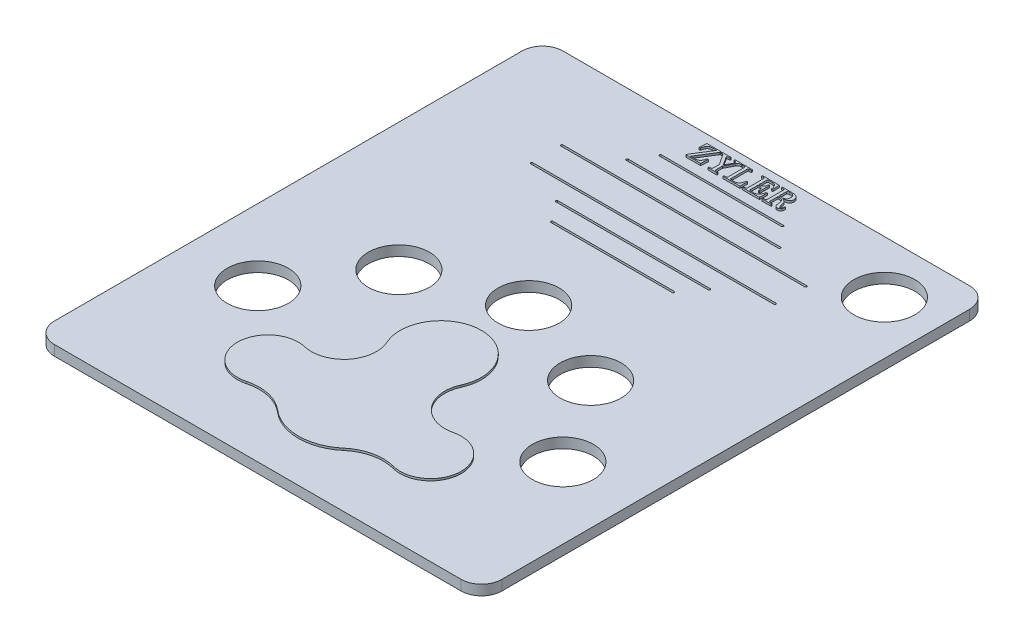
from build123d import *

# Parameters (mm, degrees)
SKETCH1_W           = 220
SKETCH1_H           = 250
BOSS_EXTRUDE1_DEPTH = 5
CUT_EXTRUDE1_DEPTH  = 20
SKETCH3_R           = 15
CUT_EXTRUDE2_DEPTH  = 20
BOSS_EXTRUDE2_DEPTH = 1
BOSS_EXTRUDE3_DEPTH = 1
FILLET1_R           = 10
SKETCH6_R           = 15
CUT_EXTRUDE3_DEPTH  = 167.583312631


with BuildPart() as part:
    # Sketch1 → Boss-Extrude1 (new body)
    with BuildSketch(Plane(origin=(0, 0, 0), x_dir=(1, 0, 0), z_dir=(0, 1, 0))):
        Rectangle(SKETCH1_W, SKETCH1_H)
    extrude(amount=BOSS_EXTRUDE1_DEPTH)

    # Sketch2 → Cut-Extrude1 (cut)
    with BuildSketch(Plane(origin=(0, 5, 0), x_dir=(1, 0, 0), z_dir=(0, 1, 0))):
        with BuildLine():
            Line((37.083433969, 94), (-37.916566031, 94))
            ThreePointArc((-37.916566031, 94), (-38.416566031, 94.5), (-37.916566031, 95))
            Line((-37.916566031, 95), (37.083433969, 95))
            ThreePointArc((37.083433969, 95), (37.583433969, 94.5), (37.083433969, 94))
        make_face()
        with BuildLine():
            Line((59.972615029, 84.007575965), (-60.027384971, 84.007575965))
            ThreePointArc((-60.027384971, 84.007575965), (-60.527384971, 84.507575965), (-60.027384971, 85.007575965))
            Line((-60.027384971, 85.007575965), (59.972615029, 85.007575965))
            ThreePointArc((59.972615029, 85.007575965), (60.472615029, 84.507575965), (59.972615029, 84.007575965))
        make_face()
        with BuildLine():
            Line((59.724735753, 69.007576115), (-59.775264247, 69.007576115))
            ThreePointArc((-59.775264247, 69.007576115), (-60.275264247, 69.507576115), (-59.775264247, 70.007576115))
            Line((-59.775264247, 70.007576115), (59.724735753, 70.007576115))
            ThreePointArc((59.724735753, 70.007576115), (60.224735753, 69.507576115), (59.724735753, 69.007576115))
        make_face()
        with BuildLine():
            Line((37.474735753, 59.007576115), (-37.525264247, 59.007576115))
            ThreePointArc((-37.525264247, 59.007576115), (-38.025264247, 59.507576115), (-37.525264247, 60.007576115))
            Line((-37.525264247, 60.007576115), (37.474735753, 60.007576115))
            ThreePointArc((37.474735753, 60.007576115), (37.974735753, 59.507576115), (37.474735753, 59.007576115))
        make_face()
        with BuildLine():
            Line((28.500891685, 104), (-31.499108315, 104))
            ThreePointArc((-31.499108315, 104), (-31.999108315, 104.5), (-31.499108315, 105))
            Line((-31.499108315, 105), (28.500891685, 105))
            ThreePointArc((28.500891685, 105), (29.000891685, 104.5), (28.500891685, 104))
        make_face()
        with BuildLine():
            Line((29.812177864, 49.007576115), (-29.862706357, 49.007576115))
            ThreePointArc((-29.862706357, 49.007576115), (-30.362706357, 49.507576115), (-29.862706357, 50.007576115))
            Line((-29.862706357, 50.007576115), (29.812177864, 50.007576115))
            ThreePointArc((29.812177864, 50.007576115), (30.312177864, 49.507576115), (29.812177864, 49.007576115))
        make_face()
    extrude(amount=-CUT_EXTRUDE1_DEPTH, mode=Mode.SUBTRACT)

    # Sketch3 → Cut-Extrude2 (cut)
    with BuildSketch(Plane(origin=(0, 5, 0), x_dir=(1, 0, 0), z_dir=(0, 1, 0))):
        with Locations(Location((-75, -50, 0), (0, 0, 270))):
            Circle(SKETCH3_R)
        with Locations(Location((-47.142827339, -8.47918677, 0), (0, 0, 270))):
            Circle(SKETCH3_R)
        with Locations(Location((0, 8.180760125, 0), (0, 0, 270))):
            Circle(SKETCH3_R)
        with Locations(Location((75, -50, 0), (0, 0, 270))):
            Circle(SKETCH3_R)
        with Locations(Location((47.142827339, -8.47918677, 0), (0, 0, 270))):
            Circle(SKETCH3_R)
    extrude(amount=-CUT_EXTRUDE2_DEPTH, mode=Mode.SUBTRACT)

    # Sketch4 → Boss-Extrude2 (add)
    with BuildSketch(Plane(origin=(0, 5, 0), x_dir=(1, 0, 0), z_dir=(0, 1, 0))):
        with BuildLine():
            ThreePointArc((18.21942281, -43.249401947), (0, -15), (-18.21942281, -43.249401947))
            ThreePointArc((-18.21942281, -43.249401947), (-20.456033843, -60.03474086), (-36.513690834, -65.410769438))
            ThreePointArc((-36.513690834, -65.410769438), (-54.998818818, -80.188239417), (-36.148648649, -94.497140848))
            ThreePointArc((-36.148648649, -94.497140848), (-25.628978083, -94.30563671), (-16.223404255, -99.021071325))
            ThreePointArc((-16.223404255, -99.021071325), (0, -105), (16.223404255, -99.021071325))
            ThreePointArc((16.223404255, -99.021071325), (25.628978083, -94.30563671), (36.148648649, -94.497140848))
            ThreePointArc((36.148648649, -94.497140848), (54.998818818, -80.188239417), (36.513690834, -65.410769438))
            ThreePointArc((36.513690834, -65.410769438), (20.456033843, -60.03474086), (18.21942281, -43.249401947))
        make_face()
    extrude(amount=BOSS_EXTRUDE2_DEPTH)

    # Sketch5 → Boss-Extrude3 (add)
    # profile 1 of 5: a face of its own
    with BuildSketch(Plane(origin=(0, 5, 0), x_dir=(1, 0, 0), z_dir=(0, 1, 0))):
        with BuildLine():
            Line((-24.154647436, 120), (-17.179487179, 120))
            Line((-17.179487179, 120), (-17.179487179, 119.487179487))
            Line((-17.179487179, 119.487179487), (-22.804487179, 110.512820513))
            Line((-22.804487179, 110.512820513), (-20.673076923, 110.512820513))
            add(Edge.make_bspline(
                [(-20.673076923, 110.512820513), (-20.526651144, 110.515887223), (-20.247389804, 110.521736014), (-19.84912992, 110.57628319), (-19.491872335, 110.66428805), (-19.173584535, 110.791911861), (-18.890563731, 110.956557482), (-18.638367295, 111.157614665), (-18.411539151, 111.391175177), (-18.248417489, 111.617899109), (-18.129942276, 111.823859128), (-18.04180762, 112.004369556), (-17.959053906, 112.210119375), (-17.874482462, 112.438237578), (-17.792689455, 112.691619812), (-17.712898856, 112.968796328), (-17.637231289, 113.271186263), (-17.5891079, 113.480817404), (-17.564102564, 113.58974359)],
                knots=[0, 0, 0, 0, 1.438938695, 2.744325145, 3.943287961, 5.047781886, 6.103944204, 7.15076122, 8.209328403, 9.295327535, 9.886501639, 10.544177767, 11.26834914, 12.065930381, 12.935805495, 13.885366719, 14.901217933, 16, 16, 16, 16], degree=3))
            Line((-17.564102564, 113.58974359), (-17.051282051, 113.58974359))
            Line((-17.051282051, 113.58974359), (-17.249599359, 110))
            Line((-17.249599359, 110), (-24.487179487, 110))
            Line((-24.487179487, 110), (-24.487179487, 110.458733974))
            Line((-24.487179487, 110.458733974), (-18.826121795, 119.487179487))
            Line((-18.826121795, 119.487179487), (-20.909455128, 119.487179487))
            add(Edge.make_bspline(
                [(-20.909455128, 119.487179487), (-21.043807402, 119.485425547), (-21.297096594, 119.482118912), (-21.653399479, 119.443458441), (-21.964378916, 119.385150531), (-22.148149278, 119.315315102), (-22.233573718, 119.282852564)],
                knots=[0, 0, 0, 0, 1.195148331, 2.253167325, 3.18799636, 4, 4, 4, 4], degree=3))
            add(Edge.make_bspline(
                [(-22.233573718, 119.282852564), (-22.286061606, 119.25827604), (-22.391152301, 119.209069182), (-22.541813204, 119.120684756), (-22.684560242, 119.018013108), (-22.819308501, 118.901332309), (-22.945792151, 118.769908876), (-23.065628563, 118.625975922), (-23.178455392, 118.468888939), (-23.282728061, 118.298058615), (-23.378354765, 118.112722554), (-23.469333318, 117.914032542), (-23.550757543, 117.69965804), (-23.624621303, 117.470071964), (-23.692796894, 117.226310318), (-23.752435357, 116.967562411), (-23.805069719, 116.694330206), (-23.832229475, 116.506535658), (-23.846153846, 116.41025641)],
                knots=[0, 0, 0, 0, 0.807180279, 1.616127815, 2.429396883, 3.253816916, 4.095946098, 4.967866624, 5.861164287, 6.78817231, 7.75355223, 8.765247396, 9.831261868, 10.946284167, 12.12452188, 13.356655795, 14.644799893, 16, 16, 16, 16], degree=3))
            Line((-23.846153846, 116.41025641), (-24.358974359, 116.41025641))
            Line((-24.358974359, 116.41025641), (-24.154647436, 120))
        make_face()
    # profile 2 of 5: a face of its own
    with BuildSketch(Plane(origin=(0, 5, 0), x_dir=(1, 0, 0), z_dir=(0, 1, 0))):
        with BuildLine():
            Line((-16.666666667, 120), (-12.307692308, 120))
            Line((-12.307692308, 120), (-12.307692308, 119.487179487))
            Line((-12.307692308, 119.487179487), (-12.760416667, 119.487179487))
            add(Edge.make_bspline(
                [(-12.760416667, 119.487179487), (-12.846619261, 119.486424128), (-13.002559406, 119.485057687), (-13.211899108, 119.466702823), (-13.374538956, 119.44314865), (-13.493287129, 119.401205813), (-13.575234414, 119.346644783), (-13.629860927, 119.283175014), (-13.667727251, 119.211211133), (-13.670476211, 119.157791294), (-13.671875, 119.130608974)],
                knots=[0, 0, 0, 0, 1.913714744, 3.461902253, 4.666412246, 5.553424366, 6.236294336, 6.825067748, 7.40214376, 8, 8, 8, 8], degree=3))
            add(Edge.make_bspline(
                [(-13.671875, 119.130608974), (-13.667805003, 119.074009925), (-13.65971831, 118.961553038), (-13.604935316, 118.863036278), (-13.577724359, 118.814102564)],
                knots=[0, 0, 0, 0, 1.006591081, 2, 2, 2, 2], degree=3))
            Line((-13.577724359, 118.814102564), (-10.987580128, 114.815705128))
            Line((-10.987580128, 114.815705128), (-9.184695513, 118.235176282))
            add(Edge.make_bspline(
                [(-9.184695513, 118.235176282), (-9.165597886, 118.272778748), (-9.127731925, 118.347335311), (-9.089751755, 118.467562005), (-9.067531445, 118.59224725), (-9.064187293, 118.677126214), (-9.0625, 118.719951923)],
                knots=[0, 0, 0, 0, 1.000544011, 1.983835969, 2.982743766, 4, 4, 4, 4], degree=3))
            add(Edge.make_bspline(
                [(-9.0625, 118.719951923), (-9.064946926, 118.775661857), (-9.069653571, 118.882819527), (-9.112889746, 119.035564249), (-9.185820396, 119.169503747), (-9.286675615, 119.28385013), (-9.411745305, 119.378065781), (-9.564875614, 119.440868838), (-9.739363051, 119.482546004), (-9.864173425, 119.48558134), (-9.929887821, 119.487179487)],
                knots=[0, 0, 0, 0, 1.018724209, 1.959508948, 2.878985283, 3.789059353, 4.733256338, 5.719300026, 6.799179769, 8, 8, 8, 8], degree=3))
            Line((-9.929887821, 119.487179487), (-10.384615385, 119.487179487))
            Line((-10.384615385, 119.487179487), (-10.384615385, 120))
            Line((-10.384615385, 120), (-6.666666667, 120))
            Line((-6.666666667, 120), (-6.666666667, 119.487179487))
            add(Edge.make_bspline(
                [(-6.666666667, 119.487179487), (-6.776976562, 119.484738833), (-6.986471081, 119.480103675), (-7.283359654, 119.439002663), (-7.543860609, 119.368009102), (-7.775289427, 119.265655716), (-7.9820443, 119.117578993), (-8.180373181, 118.924970302), (-8.373501315, 118.681796276), (-8.488874715, 118.49557784), (-8.549679487, 118.397435897)],
                knots=[0, 0, 0, 0, 1.144733651, 2.174015535, 3.102350986, 3.939892726, 4.785995591, 5.727257514, 6.802205801, 8, 8, 8, 8], degree=3))
            Line((-8.549679487, 118.397435897), (-10.769230769, 114.190705128))
            Line((-10.769230769, 114.190705128), (-10.769230769, 111.015625))
            add(Edge.make_bspline(
                [(-10.769230769, 111.015625), (-10.768016936, 110.976736695), (-10.765724465, 110.903291476), (-10.740404304, 110.801729417), (-10.695538714, 110.717095919), (-10.652231059, 110.675453519), (-10.631009615, 110.655048077)],
                knots=[0, 0, 0, 0, 1.166754949, 2.203556381, 3.119713918, 4, 4, 4, 4], degree=3))
            add(Edge.make_bspline(
                [(-10.631009615, 110.655048077), (-10.596405969, 110.632717835), (-10.52312864, 110.585430897), (-10.389433695, 110.545010103), (-10.235732773, 110.515191144), (-10.125060093, 110.513644432), (-10.066105769, 110.512820513)],
                knots=[0, 0, 0, 0, 0.831441795, 1.760676714, 2.807132964, 4, 4, 4, 4], degree=3))
            Line((-10.066105769, 110.512820513), (-9.230769231, 110.512820513))
            Line((-9.230769231, 110.512820513), (-9.230769231, 110))
            Line((-9.230769231, 110), (-13.717948718, 110))
            Line((-13.717948718, 110), (-13.717948718, 110.512820513))
            Line((-13.717948718, 110.512820513), (-12.844551282, 110.512820513))
            add(Edge.make_bspline(
                [(-12.844551282, 110.512820513), (-12.789640668, 110.513844482), (-12.687110261, 110.515756462), (-12.54645653, 110.542436781), (-12.428011355, 110.580409042), (-12.335004046, 110.640071097), (-12.264652644, 110.715038829), (-12.21262867, 110.802785346), (-12.185338447, 110.90588992), (-12.181488624, 110.978089779), (-12.179487179, 111.015625)],
                knots=[0, 0, 0, 0, 1.38374589, 2.583763285, 3.601916947, 4.50424506, 5.338860912, 6.1772126, 7.052370344, 8, 8, 8, 8], degree=3))
            Line((-12.179487179, 111.015625), (-12.179487179, 114.102564103))
            Line((-12.179487179, 114.102564103), (-15.294471154, 118.914262821))
            add(Edge.make_bspline(
                [(-15.294471154, 118.914262821), (-15.328761117, 118.963174956), (-15.394529517, 119.056988789), (-15.507703767, 119.179878436), (-15.631439347, 119.276720212), (-15.768004095, 119.355748613), (-15.933308923, 119.413345141), (-16.137940019, 119.449565637), (-16.386834772, 119.477912285), (-16.568408874, 119.483925481), (-16.666666667, 119.487179487)],
                knots=[0, 0, 0, 0, 0.914989527, 1.754956588, 2.549357515, 3.314817421, 4.162974635, 5.216717468, 6.493842491, 8, 8, 8, 8], degree=3))
            Line((-16.666666667, 119.487179487), (-16.666666667, 120))
        make_face()
    # profile 3 of 5: a face of its own
    with BuildSketch(Plane(origin=(0, 5, 0), x_dir=(1, 0, 0), z_dir=(0, 1, 0))):
        with BuildLine():
            Line((-6.282051282, 120), (-1.794871795, 120))
            Line((-1.794871795, 120), (-1.794871795, 119.487179487))
            Line((-1.794871795, 119.487179487), (-2.846554487, 119.487179487))
            add(Edge.make_bspline(
                [(-2.846554487, 119.487179487), (-2.885440617, 119.486001526), (-2.958881728, 119.483776804), (-3.061622564, 119.457717003), (-3.147966514, 119.412936681), (-3.218951315, 119.350972987), (-3.273095786, 119.268908901), (-3.306968109, 119.166795653), (-3.329400959, 119.046109242), (-3.331956444, 118.959125985), (-3.333333333, 118.912259615)],
                knots=[0, 0, 0, 0, 1.074881894, 2.03004312, 2.906641272, 3.744969235, 4.611566723, 5.594071665, 6.703691602, 8, 8, 8, 8], degree=3))
            Line((-3.333333333, 118.912259615), (-3.333333333, 111.033653846))
            add(Edge.make_bspline(
                [(-3.333333333, 111.033653846), (-3.331813547, 110.989355979), (-3.328984766, 110.906904305), (-3.298254878, 110.793661432), (-3.250136202, 110.699598774), (-3.177067476, 110.623409855), (-3.070410278, 110.570502626), (-2.929707758, 110.53798723), (-2.751708486, 110.516588987), (-2.620271509, 110.51415657), (-2.548076923, 110.512820513)],
                knots=[0, 0, 0, 0, 0.968859683, 1.803339694, 2.549864827, 3.264120922, 4.076087224, 5.119893098, 6.418039341, 8, 8, 8, 8], degree=3))
            Line((-2.548076923, 110.512820513), (-1.163862179, 110.512820513))
            add(Edge.make_bspline(
                [(-1.163862179, 110.512820513), (-1.073626073, 110.515360461), (-0.897251978, 110.520325004), (-0.638198498, 110.552495136), (-0.391521324, 110.607747699), (-0.158565788, 110.688947497), (0.061885808, 110.789451088), (0.269999641, 110.912207294), (0.464421912, 111.05983224), (0.649309266, 111.229320456), (0.820810091, 111.428075017), (0.979280348, 111.657685378), (1.123586393, 111.921559869), (1.256296259, 112.217316869), (1.378915374, 112.545800128), (1.487787352, 112.90671454), (1.58660148, 113.300385275), (1.639338344, 113.575423495), (1.666666667, 113.717948718)],
                knots=[0, 0, 0, 0, 0.916575025, 1.791523346, 2.64714501, 3.479407927, 4.292800653, 5.104749812, 5.928176648, 6.768170195, 7.648073394, 8.588823798, 9.596786844, 10.698706982, 11.879178132, 13.15579527, 14.526128792, 16, 16, 16, 16], degree=3))
            Line((1.666666667, 113.717948718), (2.179487179, 113.717948718))
            Line((2.179487179, 113.717948718), (2.051282051, 110))
            Line((2.051282051, 110), (-6.282051282, 110))
            Line((-6.282051282, 110), (-6.282051282, 110.512820513))
            Line((-6.282051282, 110.512820513), (-5.482772436, 110.512820513))
            add(Edge.make_bspline(
                [(-5.482772436, 110.512820513), (-5.419859583, 110.5144311), (-5.302547727, 110.517434317), (-5.14228296, 110.546540049), (-5.009803146, 110.593508835), (-4.90637767, 110.665797518), (-4.83217737, 110.763368693), (-4.779432882, 110.881775729), (-4.747801717, 111.024024666), (-4.745055261, 111.126962855), (-4.743589744, 111.181891026)],
                knots=[0, 0, 0, 0, 1.302472546, 2.428684546, 3.361496608, 4.194680969, 5.002904928, 5.869761089, 6.863297216, 8, 8, 8, 8], degree=3))
            Line((-4.743589744, 111.181891026), (-4.743589744, 118.98036859))
            add(Edge.make_bspline(
                [(-4.743589744, 118.98036859), (-4.74478198, 119.019911115), (-4.747035311, 119.094646655), (-4.772956929, 119.199436907), (-4.818357198, 119.28784359), (-4.87936354, 119.362707134), (-4.960071581, 119.419274336), (-5.056421517, 119.459316923), (-5.169109185, 119.483434912), (-5.249603474, 119.485878329), (-5.292467949, 119.487179487)],
                knots=[0, 0, 0, 0, 1.109388179, 2.096748346, 3.002883726, 3.882011267, 4.782692644, 5.74092925, 6.797009297, 8, 8, 8, 8], degree=3))
            Line((-5.292467949, 119.487179487), (-6.282051282, 119.487179487))
            Line((-6.282051282, 119.487179487), (-6.282051282, 120))
        make_face()
    # profile 4 of 5: a face of its own
    with BuildSketch(Plane(origin=(0, 5, 0), x_dir=(1, 0, 0), z_dir=(0, 1, 0))):
        with BuildLine():
            Line((3.205128205, 120), (11.41025641, 120))
            Line((11.41025641, 120), (11.538461538, 116.666666667))
            Line((11.538461538, 116.666666667), (11.025641026, 116.666666667))
            add(Edge.make_bspline(
                [(11.025641026, 116.666666667), (11.003009398, 116.793165235), (10.95932247, 117.037351552), (10.873429975, 117.385570812), (10.783748393, 117.705729513), (10.677982277, 117.994409143), (10.56820196, 118.25664019), (10.443096258, 118.486935057), (10.311998822, 118.69042636), (10.165559049, 118.862433066), (10.009041647, 119.009747928), (9.845413183, 119.139366932), (9.668028312, 119.246572749), (9.480072546, 119.334811394), (9.280223281, 119.402341451), (9.070749864, 119.453864858), (8.848873443, 119.48102017), (8.697314101, 119.485095143), (8.619791667, 119.487179487)],
                knots=[0, 0, 0, 0, 1.503224747, 2.90174758, 4.194974726, 5.39117008, 6.497103084, 7.517871789, 8.454010128, 9.324355652, 10.153354504, 10.966067001, 11.762006653, 12.572914456, 13.390755945, 14.22646537, 15.092839019, 16, 16, 16, 16], degree=3))
            Line((8.619791667, 119.487179487), (6.638621795, 119.487179487))
            add(Edge.make_bspline(
                [(6.638621795, 119.487179487), (6.601133814, 119.485729745), (6.529960346, 119.482977311), (6.42949637, 119.460122654), (6.345451014, 119.415710557), (6.273038956, 119.359862821), (6.217172475, 119.28449017), (6.179726825, 119.19222693), (6.158116569, 119.083517667), (6.155333458, 119.00584924), (6.153846154, 118.964342949)],
                knots=[0, 0, 0, 0, 1.101963636, 2.092152532, 2.996315777, 3.876075605, 4.759331761, 5.718090594, 6.780539293, 8, 8, 8, 8], degree=3))
            Line((6.153846154, 118.964342949), (6.153846154, 115.384615385))
            Line((6.153846154, 115.384615385), (7.011217949, 115.384615385))
            add(Edge.make_bspline(
                [(7.011217949, 115.384615385), (7.067428347, 115.385857235), (7.177153624, 115.388281385), (7.33754024, 115.416053217), (7.490126897, 115.457614902), (7.634959377, 115.515602705), (7.771319488, 115.591214201), (7.899348174, 115.683032508), (8.018671206, 115.793524157), (8.130764131, 115.918650965), (8.231847392, 116.063373152), (8.321581827, 116.224935736), (8.397630532, 116.405215747), (8.461292742, 116.602353387), (8.513836547, 116.817145533), (8.549807578, 117.050531915), (8.579631367, 117.301000832), (8.586301002, 117.474532669), (8.58974359, 117.564102564)],
                knots=[0, 0, 0, 0, 0.892705898, 1.742602891, 2.579607235, 3.40358559, 4.216064248, 5.052731945, 5.901766671, 6.796552957, 7.71838489, 8.702017051, 9.729302576, 10.823669733, 11.992571868, 13.240369499, 14.575593847, 16, 16, 16, 16], degree=3))
            Line((8.58974359, 117.564102564), (9.102564103, 117.564102564))
            Line((9.102564103, 117.564102564), (9.102564103, 112.692307692))
            Line((9.102564103, 112.692307692), (8.58974359, 112.692307692))
            add(Edge.make_bspline(
                [(8.58974359, 112.692307692), (8.586265731, 112.786539577), (8.579566761, 112.968046788), (8.550598528, 113.229448723), (8.511651313, 113.469823725), (8.459484883, 113.689423716), (8.396445844, 113.889198404), (8.317914625, 114.068139471), (8.22854959, 114.227492562), (8.125163599, 114.366049595), (8.009047179, 114.483639509), (7.887577685, 114.59073507), (7.751325065, 114.675107941), (7.60868187, 114.75011223), (7.453268844, 114.802042498), (7.290086608, 114.843188383), (7.116771156, 114.867414693), (6.997937199, 114.87031172), (6.937099359, 114.871794872)],
                knots=[0, 0, 0, 0, 1.45998059, 2.812179829, 4.070306271, 5.229180699, 6.305168593, 7.310074573, 8.250319791, 9.129367321, 9.977767917, 10.806721091, 11.630042768, 12.453299491, 13.297149633, 14.159987605, 15.057993331, 16, 16, 16, 16], degree=3))
            Line((6.937099359, 114.871794872), (6.153846154, 114.871794872))
            Line((6.153846154, 114.871794872), (6.153846154, 110.953525641))
            add(Edge.make_bspline(
                [(6.153846154, 110.953525641), (6.15595633, 110.919996696), (6.159993205, 110.855854092), (6.185615863, 110.764355772), (6.233712445, 110.686693448), (6.299177899, 110.6192891), (6.390543942, 110.571899622), (6.501932997, 110.535593711), (6.638098537, 110.517828154), (6.736081156, 110.514573644), (6.788862179, 110.512820513)],
                knots=[0, 0, 0, 0, 0.914121281, 1.74876125, 2.55680834, 3.380070406, 4.275907414, 5.328670629, 6.561015203, 8, 8, 8, 8], degree=3))
            Line((6.788862179, 110.512820513), (8.349358974, 110.512820513))
            add(Edge.make_bspline(
                [(8.349358974, 110.512820513), (8.452990942, 110.514801825), (8.65498698, 110.518663735), (8.948604957, 110.55812454), (9.2260374, 110.619527411), (9.486431641, 110.707892239), (9.731175637, 110.819799327), (9.956702119, 110.959901247), (10.166950844, 111.122986415), (10.359450559, 111.312174593), (10.535027854, 111.526649715), (10.692770112, 111.766239514), (10.835901642, 112.029824538), (10.959498377, 112.319174911), (11.064770455, 112.633930958), (11.157097758, 112.972051706), (11.231666342, 113.336043202), (11.26492821, 113.588160024), (11.282051282, 113.717948718)],
                knots=[0, 0, 0, 0, 1.026611682, 2.001037886, 2.930673832, 3.839003932, 4.721430554, 5.592063639, 6.464506044, 7.353731788, 8.261314123, 9.206649122, 10.192804653, 11.230429361, 12.320850566, 13.480043722, 14.702736958, 16, 16, 16, 16], degree=3))
            Line((11.282051282, 113.717948718), (11.794871795, 113.717948718))
            Line((11.794871795, 113.717948718), (11.666666667, 110))
            Line((11.666666667, 110), (3.205128205, 110))
            Line((3.205128205, 110), (3.205128205, 110.512820513))
            Line((3.205128205, 110.512820513), (3.952323718, 110.512820513))
            add(Edge.make_bspline(
                [(3.952323718, 110.512820513), (4.019853741, 110.513961394), (4.144831765, 110.516072825), (4.31629757, 110.54071939), (4.455880444, 110.583553093), (4.565253156, 110.644782787), (4.647398825, 110.724254735), (4.704317903, 110.820437812), (4.736645418, 110.932835377), (4.741198588, 111.012073159), (4.743589744, 111.053685897)],
                knots=[0, 0, 0, 0, 1.480088026, 2.739203531, 3.785732592, 4.664792027, 5.462122197, 6.263208317, 7.087901563, 8, 8, 8, 8], degree=3))
            Line((4.743589744, 111.053685897), (4.743589744, 118.966346154))
            add(Edge.make_bspline(
                [(4.743589744, 118.966346154), (4.741713309, 119.007892961), (4.738183175, 119.086054894), (4.710744238, 119.196350174), (4.659623106, 119.288303287), (4.588765434, 119.363500983), (4.497077138, 119.420687368), (4.383686509, 119.460135131), (4.249064694, 119.483249459), (4.152074891, 119.485816213), (4.100560897, 119.487179487)],
                knots=[0, 0, 0, 0, 1.05011629, 1.975581865, 2.84466429, 3.680648864, 4.56113492, 5.549160795, 6.698290843, 8, 8, 8, 8], degree=3))
            Line((4.100560897, 119.487179487), (3.205128205, 119.487179487))
            Line((3.205128205, 119.487179487), (3.205128205, 120))
        make_face()
    # profile 5 of 5: a face of its own
    with BuildSketch(Plane(origin=(0, 5, 0), x_dir=(1, 0, 0), z_dir=(0, 1, 0))):
        with BuildLine():
            Line((12.948717949, 120), (18.040865385, 120))
            add(Edge.make_bspline(
                [(18.040865385, 120), (18.161136225, 119.998361102), (18.394789227, 119.995177176), (18.734861671, 119.962406956), (19.053901405, 119.909539089), (19.351810526, 119.832766542), (19.6299453, 119.737278524), (19.887414165, 119.619252404), (20.123902512, 119.478192559), (20.33746379, 119.315438334), (20.53055709, 119.138010034), (20.697345087, 118.944747046), (20.839571972, 118.739072012), (20.953906691, 118.518572485), (21.045089058, 118.285116357), (21.108441399, 118.037590399), (21.147832629, 117.777046001), (21.151813068, 117.598969061), (21.153846154, 117.508012821)],
                knots=[0, 0, 0, 0, 1.283879857, 2.49422373, 3.644109154, 4.733564, 5.775312755, 6.780226247, 7.752329523, 8.709173768, 9.642539369, 10.547364715, 11.429401853, 12.306410462, 13.193533583, 14.099706314, 15.029388263, 16, 16, 16, 16], degree=3))
            add(Edge.make_bspline(
                [(21.153846154, 117.508012821), (21.150554768, 117.399479711), (21.144093621, 117.186424101), (21.076574524, 116.877154243), (20.972783088, 116.585125438), (20.825533113, 116.313955837), (20.639153533, 116.065174938), (20.415454969, 115.841526515), (20.15302855, 115.646235623), (19.906780132, 115.505586941), (19.684308226, 115.408690422), (19.493680243, 115.337570962), (19.278601747, 115.277559696), (19.042119016, 115.21940686), (18.78366631, 115.165247294), (18.502963088, 115.117723906), (18.199700361, 115.075363194), (17.989527082, 115.053432469), (17.880608974, 115.042067308)],
                knots=[0, 0, 0, 0, 1.137224841, 2.232425953, 3.305140778, 4.380461003, 5.456671101, 6.556546416, 7.687407718, 8.879760467, 9.522878125, 10.232239294, 11.012772474, 11.864150045, 12.787583039, 13.782812018, 14.85098657, 16, 16, 16, 16], degree=3))
            add(Edge.make_bspline(
                [(17.880608974, 115.042067308), (17.958854446, 115.02044141), (18.109787054, 114.978725857), (18.325139194, 114.912092122), (18.523051034, 114.849165227), (18.700128903, 114.782563471), (18.859564312, 114.718821895), (18.999695579, 114.655445198), (19.120839868, 114.591256319), (19.256170985, 114.506816609), (19.403189762, 114.389579718), (19.563579018, 114.236012501), (19.701370755, 114.059402919), (19.804380708, 113.896758027), (19.878724967, 113.74642081), (19.931737723, 113.605561476), (19.98787349, 113.440928581), (20.041417662, 113.248732753), (20.094737389, 113.031460274), (20.149129008, 112.787736289), (20.202609282, 112.51846229), (20.236675046, 112.329782589), (20.254407051, 112.231570513)],
                knots=[0, 0, 0, 0, 1.206438829, 2.327175689, 3.350287853, 4.292307306, 5.138200021, 5.902044599, 6.576893256, 7.174411928, 8.270266093, 9.365086199, 10.467079651, 11.590581327, 12.220829487, 12.956161795, 13.825482602, 14.805624267, 15.920059975, 17.150426224, 18.516732029, 20, 20, 20, 20], degree=3))
            add(Edge.make_bspline(
                [(20.254407051, 112.231570513), (20.26701134, 112.160631019), (20.291491531, 112.022851534), (20.339427359, 111.825170072), (20.384585049, 111.640848318), (20.441520968, 111.473746522), (20.494264555, 111.319441138), (20.558699823, 111.183188822), (20.620928832, 111.058799872), (20.670951747, 110.985110339), (20.695112179, 110.949519231)],
                knots=[0, 0, 0, 0, 1.265772579, 2.458397796, 3.57407367, 4.598249002, 5.559666784, 6.436597769, 7.244896572, 8, 8, 8, 8], degree=3))
            add(Edge.make_bspline(
                [(20.695112179, 110.949519231), (20.730961015, 110.903361836), (20.797402631, 110.817814513), (20.913670463, 110.71768765), (21.037137759, 110.653790235), (21.123813174, 110.645195526), (21.165865385, 110.641025641)],
                knots=[0, 0, 0, 0, 1.199130811, 2.222448485, 3.137587403, 4, 4, 4, 4], degree=3))
            add(Edge.make_bspline(
                [(21.165865385, 110.641025641), (21.209320296, 110.645702761), (21.298563322, 110.655308126), (21.42635283, 110.724458565), (21.54426229, 110.83513329), (21.637062614, 110.955901027), (21.706006769, 111.075706903), (21.754501055, 111.185720676), (21.795806534, 111.31202344), (21.831003286, 111.45489247), (21.863395338, 111.613136367), (21.888962028, 111.78770659), (21.908490839, 111.97825543), (21.918089616, 112.110681557), (21.923076923, 112.179487179)],
                knots=[0, 0, 0, 0, 0.841138524, 1.72743991, 2.754725145, 3.964622261, 4.666710373, 5.432135723, 6.292307162, 7.241054536, 8.285106602, 9.424516758, 10.661837121, 12, 12, 12, 12], degree=3))
            Line((21.923076923, 112.179487179), (22.307692308, 112.179487179))
            add(Edge.make_bspline(
                [(22.307692308, 112.179487179), (22.301356635, 112.086576831), (22.289018631, 111.905644463), (22.254407028, 111.644336799), (22.210927533, 111.400023801), (22.155749495, 111.174162001), (22.087152777, 110.965970177), (22.007892933, 110.776118231), (21.916866112, 110.603731928), (21.815829596, 110.448678127), (21.699642671, 110.31326297), (21.574344166, 110.19427429), (21.43544799, 110.095402759), (21.287201728, 110.011663494), (21.124540844, 109.950714977), (20.95245696, 109.903587282), (20.767963094, 109.878283449), (20.641761257, 109.873997068), (20.576923077, 109.871794872)],
                knots=[0, 0, 0, 0, 1.379193329, 2.685822633, 3.902295341, 5.05381776, 6.126696511, 7.14627144, 8.097589069, 9.011132489, 9.881232234, 10.734986358, 11.564030858, 12.400827998, 13.249467195, 14.130017788, 15.039267208, 16, 16, 16, 16], degree=3))
            add(Edge.make_bspline(
                [(20.576923077, 109.871794872), (20.495914883, 109.874895922), (20.337871421, 109.880945937), (20.108573692, 109.927561958), (19.896284247, 110.006874388), (19.699678926, 110.114308949), (19.526351074, 110.257117803), (19.37432477, 110.427891613), (19.243918326, 110.628078863), (19.18103702, 110.778080952), (19.148637821, 110.85536859)],
                knots=[0, 0, 0, 0, 1.047310067, 2.043256379, 3.010632594, 3.969450702, 4.927140125, 5.899707092, 6.917837227, 8, 8, 8, 8], degree=3))
            add(Edge.make_bspline(
                [(19.148637821, 110.85536859), (19.136178551, 110.891959746), (19.107479089, 110.976246106), (19.07065447, 111.122939738), (19.033441787, 111.306294857), (18.992996133, 111.526544787), (18.954572111, 111.784028877), (18.911399294, 112.07760107), (18.870352016, 112.408380461), (18.842698202, 112.641547212), (18.828125, 112.764423077)],
                knots=[0, 0, 0, 0, 0.478390711, 1.10195509, 1.870434605, 2.794664839, 3.873792197, 5.093131774, 6.468118011, 8, 8, 8, 8], degree=3))
            add(Edge.make_bspline(
                [(18.828125, 112.764423077), (18.820182954, 112.836641729), (18.804919086, 112.975439212), (18.770978804, 113.174692982), (18.738655084, 113.358194147), (18.699859777, 113.525783384), (18.65920516, 113.677342314), (18.612148217, 113.811865983), (18.565644648, 113.931702353), (18.492860838, 114.067150483), (18.386270633, 114.220457145), (18.229476946, 114.383752365), (18.038676975, 114.523890107), (17.822808506, 114.648929785), (17.578091994, 114.748240958), (17.3096212, 114.819650002), (17.018765384, 114.865096064), (16.817084321, 114.86951081), (16.712740385, 114.871794872)],
                knots=[0, 0, 0, 0, 1.028548164, 1.976773217, 2.861390999, 3.666484284, 4.412018593, 5.081814562, 5.684068578, 6.229699931, 7.255288488, 8.31854149, 9.419144819, 10.596629043, 11.843300618, 13.146114873, 14.523482561, 16, 16, 16, 16], degree=3))
            Line((16.712740385, 114.871794872), (15.897435897, 114.871794872))
            Line((15.897435897, 114.871794872), (15.897435897, 110.987580128))
            add(Edge.make_bspline(
                [(15.897435897, 110.987580128), (15.898639425, 110.949314972), (15.900885078, 110.877916295), (15.925607434, 110.78046739), (15.962093578, 110.697638892), (16.002270754, 110.658085606), (16.021634615, 110.639022436)],
                knots=[0, 0, 0, 0, 1.200674003, 2.240328943, 3.151905871, 4, 4, 4, 4], degree=3))
            add(Edge.make_bspline(
                [(16.021634615, 110.639022436), (16.050895431, 110.618775267), (16.112282052, 110.576298484), (16.228005449, 110.540825589), (16.361761139, 110.516443532), (16.45885004, 110.51407729), (16.510416667, 110.512820513)],
                knots=[0, 0, 0, 0, 0.826964289, 1.734898464, 2.796941306, 4, 4, 4, 4], degree=3))
            Line((16.510416667, 110.512820513), (17.435897436, 110.512820513))
            Line((17.435897436, 110.512820513), (17.435897436, 110))
            Line((17.435897436, 110), (12.948717949, 110))
            Line((12.948717949, 110), (12.948717949, 110.512820513))
            Line((12.948717949, 110.512820513), (13.886217949, 110.512820513))
            add(Edge.make_bspline(
                [(13.886217949, 110.512820513), (13.934419276, 110.514119365), (14.024832502, 110.516555675), (14.150632485, 110.540443522), (14.257195947, 110.57909088), (14.342315949, 110.637231074), (14.407777564, 110.708785561), (14.454977755, 110.792246474), (14.481282797, 110.888561684), (14.485144694, 110.956035368), (14.487179487, 110.991586538)],
                knots=[0, 0, 0, 0, 1.322849184, 2.481323038, 3.503366862, 4.414154492, 5.284122715, 6.146514873, 7.023418293, 8, 8, 8, 8], degree=3))
            Line((14.487179487, 110.991586538), (14.487179487, 118.974358974))
            add(Edge.make_bspline(
                [(14.487179487, 118.974358974), (14.485037977, 119.014510705), (14.480989979, 119.090407664), (14.456675332, 119.198375793), (14.406525447, 119.287719193), (14.340901728, 119.363530347), (14.253788093, 119.419679931), (14.148259759, 119.460158212), (14.023413621, 119.483172446), (13.933722766, 119.485792025), (13.886217949, 119.487179487)],
                knots=[0, 0, 0, 0, 1.066531836, 2.016015794, 2.903845426, 3.757070895, 4.651239732, 5.621644264, 6.74030242, 8, 8, 8, 8], degree=3))
            Line((13.886217949, 119.487179487), (12.948717949, 119.487179487))
            Line((12.948717949, 119.487179487), (12.948717949, 120))
        make_face()
        with BuildLine():
            Line((15.897435897, 115.384615385), (17.039262821, 115.384615385))
            add(Edge.make_bspline(
                [(17.039262821, 115.384615385), (17.132767833, 115.386461741), (17.313985577, 115.390040078), (17.578491851, 115.408850872), (17.826929046, 115.446377368), (18.061465814, 115.491814136), (18.278343341, 115.557629871), (18.481179024, 115.632536536), (18.666548969, 115.725786762), (18.840140282, 115.828583337), (18.993175722, 115.954113844), (19.128508425, 116.099520278), (19.237850448, 116.27118509), (19.331017152, 116.461568319), (19.399778174, 116.675104762), (19.45274555, 116.908826944), (19.481672732, 117.165409221), (19.485302144, 117.343683586), (19.487179487, 117.435897436)],
                knots=[0, 0, 0, 0, 1.219595185, 2.363641091, 3.454730401, 4.494761589, 5.475621669, 6.407157146, 7.310634959, 8.178322238, 9.032401173, 9.882921431, 10.757225062, 11.676345793, 12.640127146, 13.675298604, 14.79752949, 16, 16, 16, 16], degree=3))
            add(Edge.make_bspline(
                [(19.487179487, 117.435897436), (19.483948977, 117.560866315), (19.477811199, 117.798299793), (19.436484012, 118.135050746), (19.358384177, 118.429791565), (19.252617665, 118.68481163), (19.118577427, 118.898354249), (18.968491565, 119.078838987), (18.794769551, 119.219786278), (18.631078523, 119.308135519), (18.482012902, 119.360926944), (18.345618663, 119.394079708), (18.185867947, 119.423933866), (18.001243389, 119.447400329), (17.793319295, 119.464341355), (17.561607679, 119.478898796), (17.305741142, 119.486537208), (17.126740399, 119.486959129), (17.033253205, 119.487179487)],
                knots=[0, 0, 0, 0, 1.583904885, 3.009325589, 4.288147178, 5.437094785, 6.493769576, 7.47222241, 8.398684323, 9.311127006, 9.814333876, 10.39927682, 11.088061335, 11.873191318, 12.756563886, 13.731534083, 14.815242278, 16, 16, 16, 16], degree=3))
            add(Edge.make_bspline(
                [(17.033253205, 119.487179487), (16.971826818, 119.486547548), (16.855637777, 119.485352225), (16.690517085, 119.483108567), (16.544381915, 119.471708376), (16.415851112, 119.461222268), (16.305796489, 119.444354197), (16.212640183, 119.4283459), (16.13884144, 119.40456351), (16.065531344, 119.370489462), (15.995642947, 119.312679595), (15.93845738, 119.222625267), (15.903189793, 119.11374132), (15.899444606, 119.034752836), (15.897435897, 118.992387821)],
                knots=[0, 0, 0, 0, 1.568367801, 2.966593976, 4.213901723, 5.309659579, 6.257081416, 7.056086357, 7.719147992, 8.229973534, 9.113927885, 9.988629374, 10.921213019, 12, 12, 12, 12], degree=3))
            Line((15.897435897, 118.992387821), (15.897435897, 115.384615385))
        make_face(mode=Mode.SUBTRACT)
    extrude(amount=BOSS_EXTRUDE3_DEPTH)

    # Fillet1
    fillet1_edges = [part.edges().sort_by_distance(p)[0] for p in [
        (110, 2.5, 125),
        (-110, 2.5, 125),
        (-110, 2.5, -125),
        (110, 2.5, -125),
    ]]
    fillet(fillet1_edges, radius=FILLET1_R)

    # Sketch6 → Cut-Extrude3 (cut, through all)
    with BuildSketch(Plane(origin=(0, 5, 0), x_dir=(1, 0, 0), z_dir=(0, 1, 0))):
        with Locations(Location((83.896891776, 99.182445983, 0), (0, 0, 270))):
            Circle(SKETCH6_R)
    extrude(amount=-CUT_EXTRUDE3_DEPTH, mode=Mode.SUBTRACT)


solid = part.part
